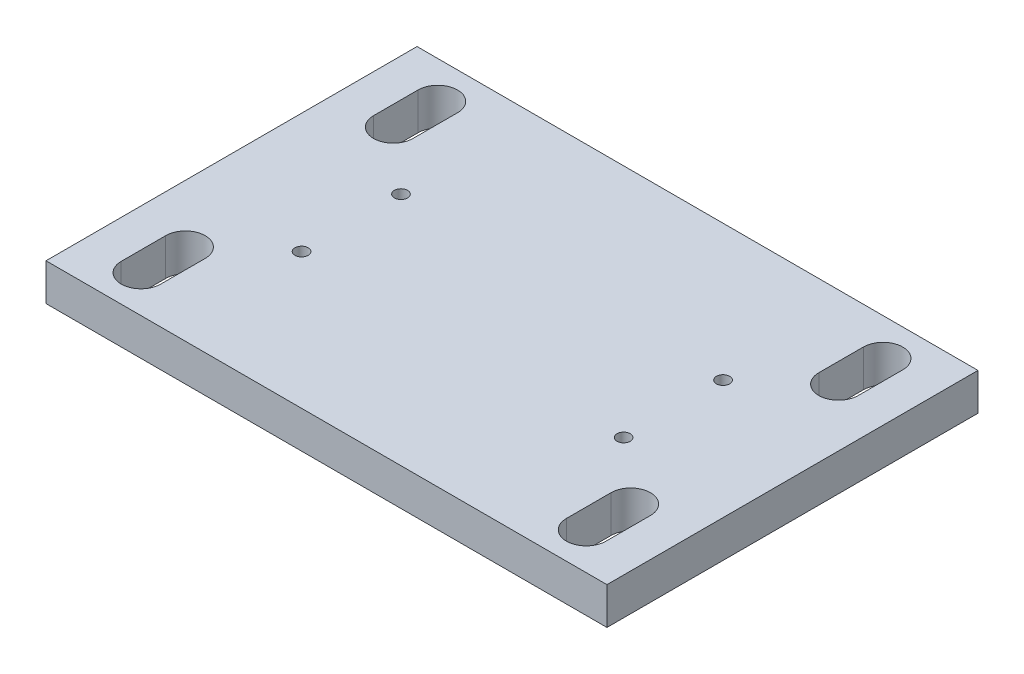
from build123d import *

# Parameters (mm, degrees)
SKETCH1_W                              = 96
SKETCH1_H                              = 63.5
MOUNT_BLOCK_DEPTH                      = 6.35
LINEAR_STAGE_4_40_TAPPED_HOLE_D        = 2.2606
OPTICAL_TABLE_1_4_0_25_DIAMETER_HOLE_D = 6.35
OPTICAL_TASBLE_CUT_EXTRUDE_DEPTH       = 6.35


with BuildPart() as part:
    # Sketch1 → Mount Block (new body)
    with BuildSketch(Plane(origin=(0, 0, 0), x_dir=(1, 0, 0), z_dir=(0, 1, 0))):
        Rectangle(SKETCH1_W, SKETCH1_H)
    extrude(amount=MOUNT_BLOCK_DEPTH)

    # Linear Stage #4-40 Tapped Hole (through all)
    with Locations(Plane(origin=(0, 6.35, 0), x_dir=(1, 0, 0), z_dir=(0, 1, 0))):
        with Locations((-27.5, 8.5), (27.618, 8.5), (27.618, -8.518), (-27.5, -8.518)):
            Hole(LINEAR_STAGE_4_40_TAPPED_HOLE_D / 2)

    # Optical Table 1/4 (0.25) Diameter Hole (through all)
    with Locations(Plane(origin=(0, 6.35, 0), x_dir=(1, 0, 0), z_dir=(0, 1, 0))):
        with Locations((-38.1, 25.4), (38.1, 25.4), (38.1, -25.4), (-38.1, -25.4)):
            Hole(OPTICAL_TABLE_1_4_0_25_DIAMETER_HOLE_D / 2)

    # Sketch6 → Optical Tasble Cut-Extrude (cut)
    with BuildSketch(Plane(origin=(0, 6.35, 0), x_dir=(1, 0, 0), z_dir=(0, 1, 0))):
        with BuildLine():
            Line((-34.7218, 25.4), (-34.7218, 17.78))
            ThreePointArc((-34.7218, 17.78), (-38.1, 14.4018), (-41.4782, 17.78))
            Line((-41.4782, 17.78), (-41.4782, 25.4))
            ThreePointArc((-41.4782, 25.4), (-38.1, 28.7782), (-34.7218, 25.4))
        make_face()
        with BuildLine():
            Line((41.4782, 25.4), (41.4782, 17.78))
            ThreePointArc((41.4782, 17.78), (38.1, 14.4018), (34.7218, 17.78))
            Line((34.7218, 17.78), (34.7218, 25.4))
            ThreePointArc((34.7218, 25.4), (38.1, 28.7782), (41.4782, 25.4))
        make_face()
        with BuildLine():
            Line((41.4782, -17.78), (41.4782, -25.4))
            ThreePointArc((41.4782, -25.4), (38.1, -28.7782), (34.7218, -25.4))
            Line((34.7218, -25.4), (34.7218, -17.78))
            ThreePointArc((34.7218, -17.78), (38.1, -14.4018), (41.4782, -17.78))
        make_face()
        with BuildLine():
            Line((-34.7218, -17.78), (-34.7218, -25.4))
            ThreePointArc((-34.7218, -25.4), (-38.1, -28.7782), (-41.4782, -25.4))
            Line((-41.4782, -25.4), (-41.4782, -17.78))
            ThreePointArc((-41.4782, -17.78), (-38.1, -14.4018), (-34.7218, -17.78))
        make_face()
    extrude(amount=-OPTICAL_TASBLE_CUT_EXTRUDE_DEPTH, mode=Mode.SUBTRACT)


solid = part.part
